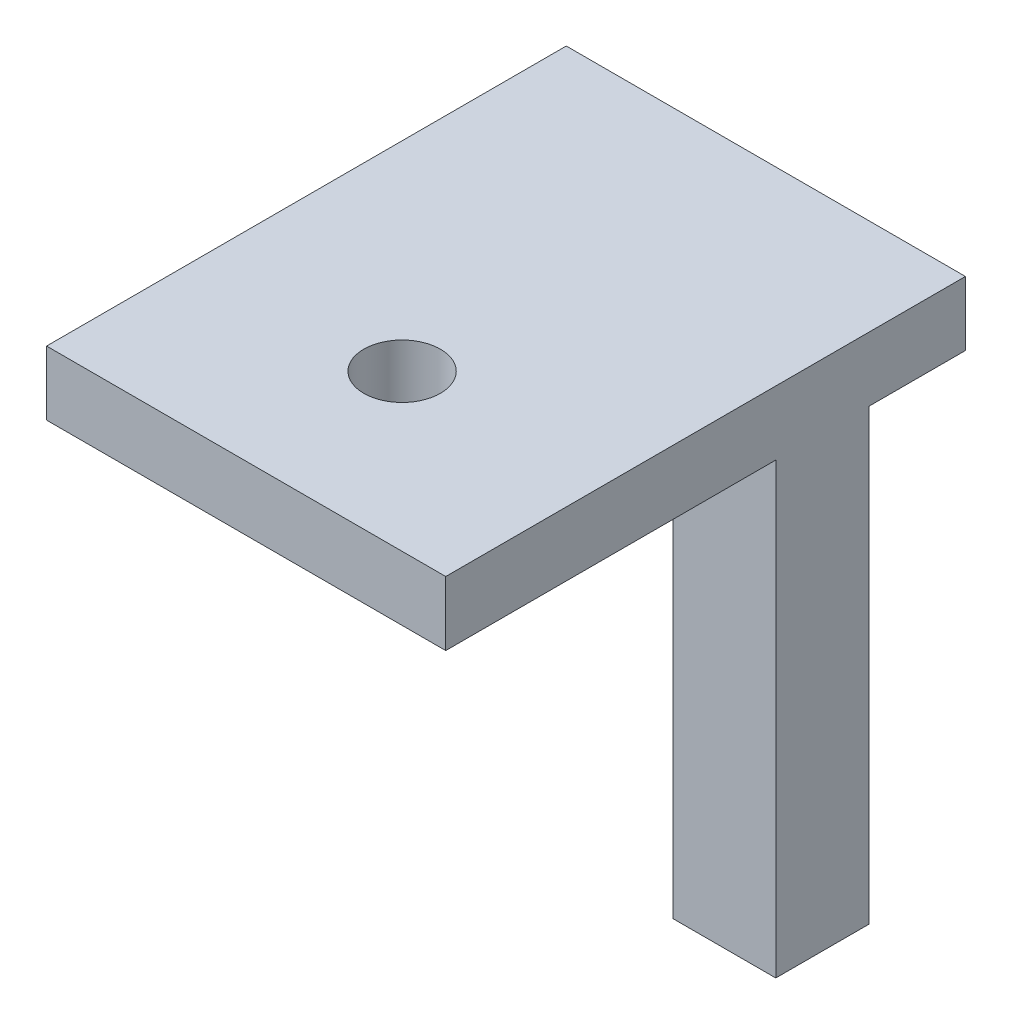
from build123d import *

# Parameters (mm, degrees)
SKETCH1_W           = 62.2
SKETCH1_H           = 80.98413
BOSS_EXTRUDE1_DEPTH = 10
SKETCH2_R           = 5.969
CUT_EXTRUDE1_DEPTH  = 10
SKETCH3_W           = 16
SKETCH3_H           = 14.55264
BOSS_EXTRUDE2_DEPTH = 69.9


with BuildPart() as part:
    # Sketch1 → Boss-Extrude1 (new body)
    with BuildSketch(Plane(origin=(0, 0, 0), x_dir=(1, 0, 0), z_dir=(0, 1, 0))):
        Rectangle(SKETCH1_W, SKETCH1_H)
    extrude(amount=BOSS_EXTRUDE1_DEPTH)

    # Sketch2 → Cut-Extrude1 (cut)
    with BuildSketch(Plane(origin=(0, 10, 0), x_dir=(1, 0, 0), z_dir=(0, 1, 0))):
        with Locations(Location((0, -16.192065, 0), (0, 0, 270))):
            Circle(SKETCH2_R)
    extrude(amount=-CUT_EXTRUDE1_DEPTH, mode=Mode.SUBTRACT)

    # Sketch3 → Boss-Extrude2 (add)
    with BuildSketch(Plane.XZ):
        with Locations((23.1, -18.215745)):
            Rectangle(SKETCH3_W, SKETCH3_H)
    extrude(amount=BOSS_EXTRUDE2_DEPTH)


solid = part.part
